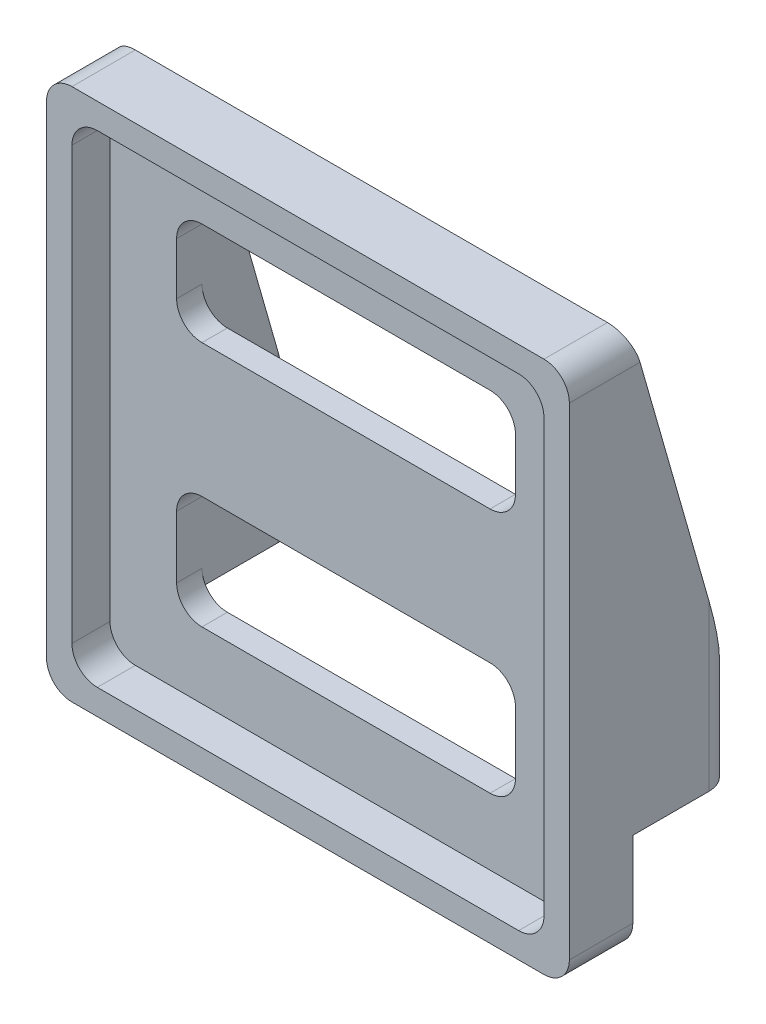
from build123d import *

# Parameters (mm, degrees)
SKETCH1_W           = 41.2
SKETCH1_H           = 42
BOSS_EXTRUDE1_DEPTH = 5
CUT_EXTRUDE1_DEPTH  = 3
CUT_EXTRUDE2_DEPTH  = 2
SKETCH8_W           = 7.25
SKETCH8_H           = 6
BOSS_EXTRUDE4_DEPTH = 8
SKETCH9_W           = 7.25
SKETCH9_H           = 6
BOSS_EXTRUDE5_DEPTH = 8
SKETCH12_R          = 2
CUT_EXTRUDE4_DEPTH  = 6
BOSS_EXTRUDE6_DEPTH = 7.25
FILLET1_R           = 2
FILLET2_R           = 2


with BuildPart() as part:
    # Sketch1 → Boss-Extrude1 (new body)
    with BuildSketch(Plane.XY):
        with Locations((20.6, -21)):
            Rectangle(SKETCH1_W, SKETCH1_H)
    extrude(amount=BOSS_EXTRUDE1_DEPTH)

    # Sketch2 → Cut-Extrude1 (cut)
    with BuildSketch(Plane.XY.offset(5)):
        with BuildLine():
            Line((4, -2), (37.2, -2))
            ThreePointArc((37.2, -2), (38.614213562, -2.585786438), (39.2, -4))
            Line((39.2, -4), (39.2, -38))
            ThreePointArc((39.2, -38), (38.614213562, -39.414213562), (37.2, -40))
            Line((37.2, -40), (4, -40))
            ThreePointArc((4, -40), (2.585786438, -39.414213562), (2, -38))
            Line((2, -38), (2, -4))
            ThreePointArc((2, -4), (2.585786438, -2.585786438), (4, -2))
        make_face()
    extrude(amount=-CUT_EXTRUDE1_DEPTH, mode=Mode.SUBTRACT)

    # Sketch3 → Cut-Extrude2 (cut)
    with BuildSketch(Plane.XY.offset(2)):
        with BuildLine():
            Line((9.25, -7.25), (31.95, -7.25))
            ThreePointArc((31.95, -7.25), (33.364213562, -7.835786438), (33.95, -9.25))
            Line((33.95, -9.25), (33.95, -13.35))
            ThreePointArc((33.95, -13.35), (33.364213562, -14.764213562), (31.95, -15.35))
            Line((31.95, -15.35), (9.25, -15.35))
            ThreePointArc((9.25, -15.35), (7.835786438, -14.764213562), (7.25, -13.35))
            Line((7.25, -13.35), (7.25, -9.25))
            ThreePointArc((7.25, -9.25), (7.835786438, -7.835786438), (9.25, -7.25))
        make_face()
        with BuildLine():
            Line((9.25, -25.85), (31.95, -25.85))
            ThreePointArc((31.95, -25.85), (33.364213562, -26.435786438), (33.95, -27.85))
            Line((33.95, -27.85), (33.95, -32.75))
            ThreePointArc((33.95, -32.75), (33.364213562, -34.164213562), (31.95, -34.75))
            Line((31.95, -34.75), (9.25, -34.75))
            ThreePointArc((9.25, -34.75), (7.835786438, -34.164213562), (7.25, -32.75))
            Line((7.25, -32.75), (7.25, -27.85))
            ThreePointArc((7.25, -27.85), (7.835786438, -26.435786438), (9.25, -25.85))
        make_face()
    extrude(amount=-CUT_EXTRUDE2_DEPTH, mode=Mode.SUBTRACT)

    # Sketch8 → Boss-Extrude4 (add)
    with BuildSketch(Plane(origin=(0, 0, 0), x_dir=(-1, 0, 0), z_dir=(0, 0, -1))):
        with Locations((-37.575, -31)):
            Rectangle(SKETCH8_W, SKETCH8_H)
    extrude(amount=BOSS_EXTRUDE4_DEPTH)

    # Sketch9 → Boss-Extrude5 (add)
    with BuildSketch(Plane(origin=(0, 0, 0), x_dir=(-1, 0, 0), z_dir=(0, 0, -1))):
        with Locations((-3.625, -31)):
            Rectangle(SKETCH9_W, SKETCH9_H)
    extrude(amount=BOSS_EXTRUDE5_DEPTH)

    # Sketch12 → Cut-Extrude4 (cut)
    with BuildSketch(Plane(origin=(0, -28, 0), x_dir=(1, 0, 0), z_dir=(0, 1, 0))):
        with Locations(Location((37.575, 4, 0), (0, 0, 270))):
            Circle(SKETCH12_R)
    cut_extrude4 = extrude(amount=-CUT_EXTRUDE4_DEPTH, mode=Mode.SUBTRACT)

    # Sketch13 → Boss-Extrude6 (add)
    with BuildSketch(Plane(origin=(41.2, 0, 0), x_dir=(0, 0, -1), z_dir=(1, 0, 0))):
        Polygon((8, -28), (0, 0), (0, -28), align=None)
    boss_extrude6 = extrude(amount=-BOSS_EXTRUDE6_DEPTH)

    # Mirror2: Cut-Extrude4, Boss-Extrude6 across plane
    add(cut_extrude4.mirror(Plane(origin=(20.6, 0, 0), x_dir=(0, 0, 1), z_dir=(1, 0, 0))), mode=Mode.SUBTRACT)
    add(boss_extrude6.mirror(Plane(origin=(20.6, 0, 0), x_dir=(0, 0, 1), z_dir=(1, 0, 0))))

    # Fillet1
    fillet1_edges = [part.edges().sort_by_distance(p)[0] for p in [
        (0, 0, 2.5),
        (41.2, 0, 2.5),
        (41.2, -42, 2.5),
        (0, -42, 2.5),
    ]]
    fillet(fillet1_edges, radius=FILLET1_R)

    # Fillet2
    fillet2_edges = [part.edges().sort_by_distance(p)[0] for p in [
        (0, -31, -8),
        (7.25, -31, -8),
        (41.2, -31, -8),
        (33.95, -31, -8),
    ]]
    fillet(fillet2_edges, radius=FILLET2_R)


solid = part.part
